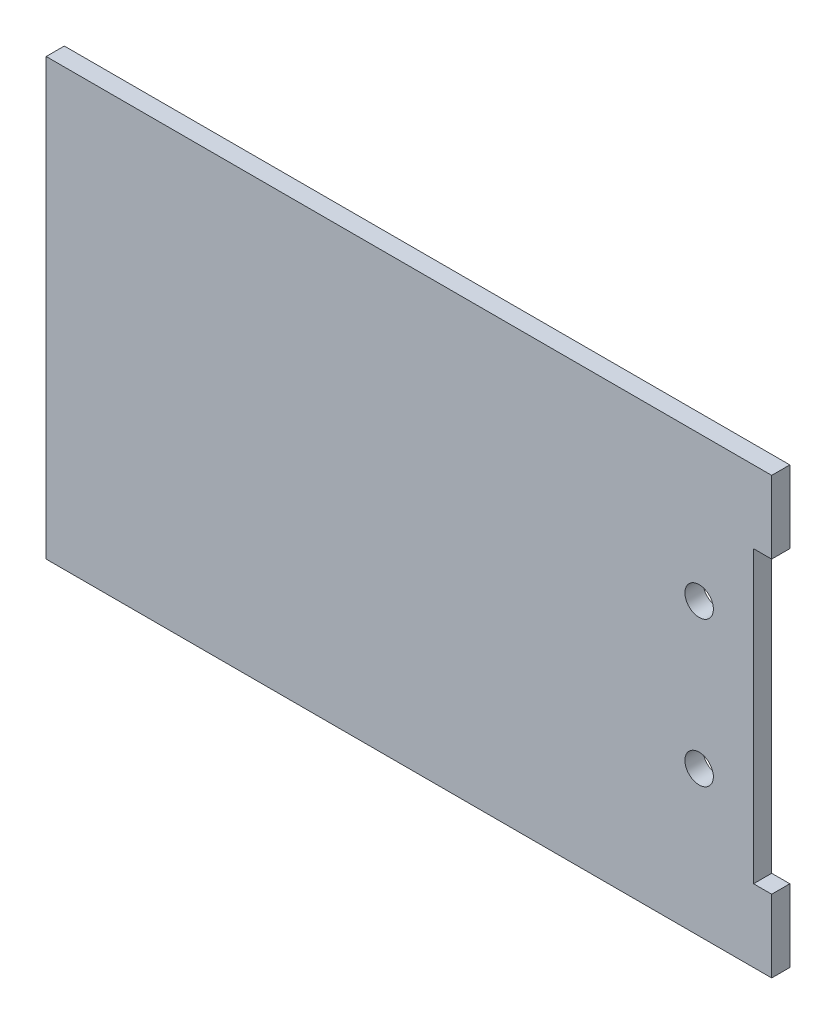
from build123d import *

# Parameters (mm, degrees)
SKETCH1_W                  = 76.2
SKETCH1_H                  = 127
BOSS_EXTRUDE1_DEPTH        = 3.175
F_9_0_196_DIAMETER_HOLE1_D = 4.9784
CUT_EXTRUDE1_DEPTH         = 75.121121315
CUT_EXTRUDE1_DEPTH_BACK    = 75.121121315


with BuildPart() as part:
    # Sketch1 → Boss-Extrude1 (new body)
    with BuildSketch(Plane(origin=(0, 0, 0), x_dir=(0, 1, 0), z_dir=(0, 0, 1))):
        Rectangle(SKETCH1_W, SKETCH1_H)
    extrude(amount=BOSS_EXTRUDE1_DEPTH)

    # #9 (0.196) Diameter Hole1 (through all)
    with Locations(Plane.XY.offset(3.175)):
        with Locations((50.8, -12.7), (50.8, 12.7)):
            Hole(F_9_0_196_DIAMETER_HOLE1_D / 2)

    # Sketch4 → Cut-Extrude1 (cut, two sides: drawn at the far end of the back side and taken through both)
    with BuildSketch(Plane.XY.offset(3.175).offset(-CUT_EXTRUDE1_DEPTH_BACK)):
        Polygon((357.480633142, 25.4), (63.5, 25.4), (60.325, 25.4), (60.325, -25.4), (63.5, -25.4), (357.480633142, -25.4), (945.441899427, -25.4), (945.441899427, 25.4), align=None)
    extrude(amount=CUT_EXTRUDE1_DEPTH + CUT_EXTRUDE1_DEPTH_BACK, mode=Mode.SUBTRACT)


solid = part.part
